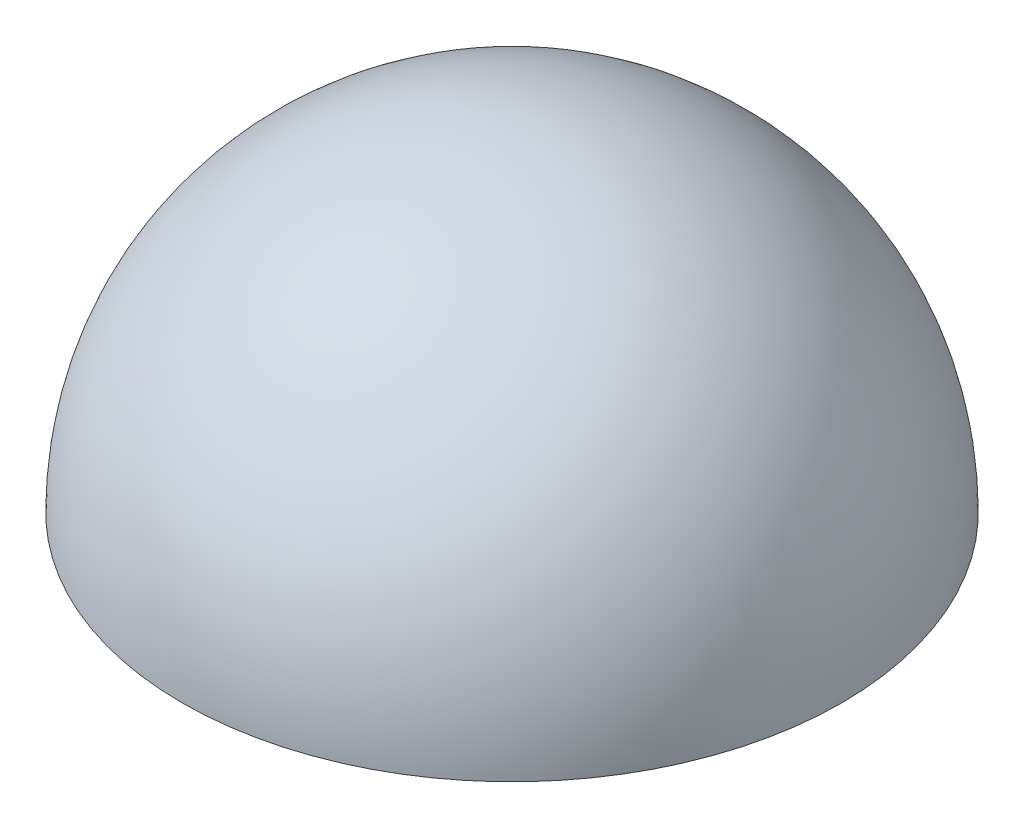
from build123d import *

# Parameters (mm, degrees)
SHELL1_T = -5


with BuildPart() as part:
    # Sketch1 → Revolve1 (revolve)
    with BuildSketch(Plane.XY):
        with BuildLine():
            Line((-25, 0), (0, 0))
            Line((0, 0), (0, 25))
            ThreePointArc((0, 25), (-17.67766953, 17.67766953), (-25, 0))
        make_face()
    revolve(axis=Axis((0, 0, 0), (0, 1, 0)))

    # Shell1
    shell1_openings = [part.faces().sort_by_distance(p)[0] for p in [
        (0, 0, 0),
    ]]
    offset(amount=SHELL1_T, openings=shell1_openings, kind=Kind.INTERSECTION)


solid = part.part
